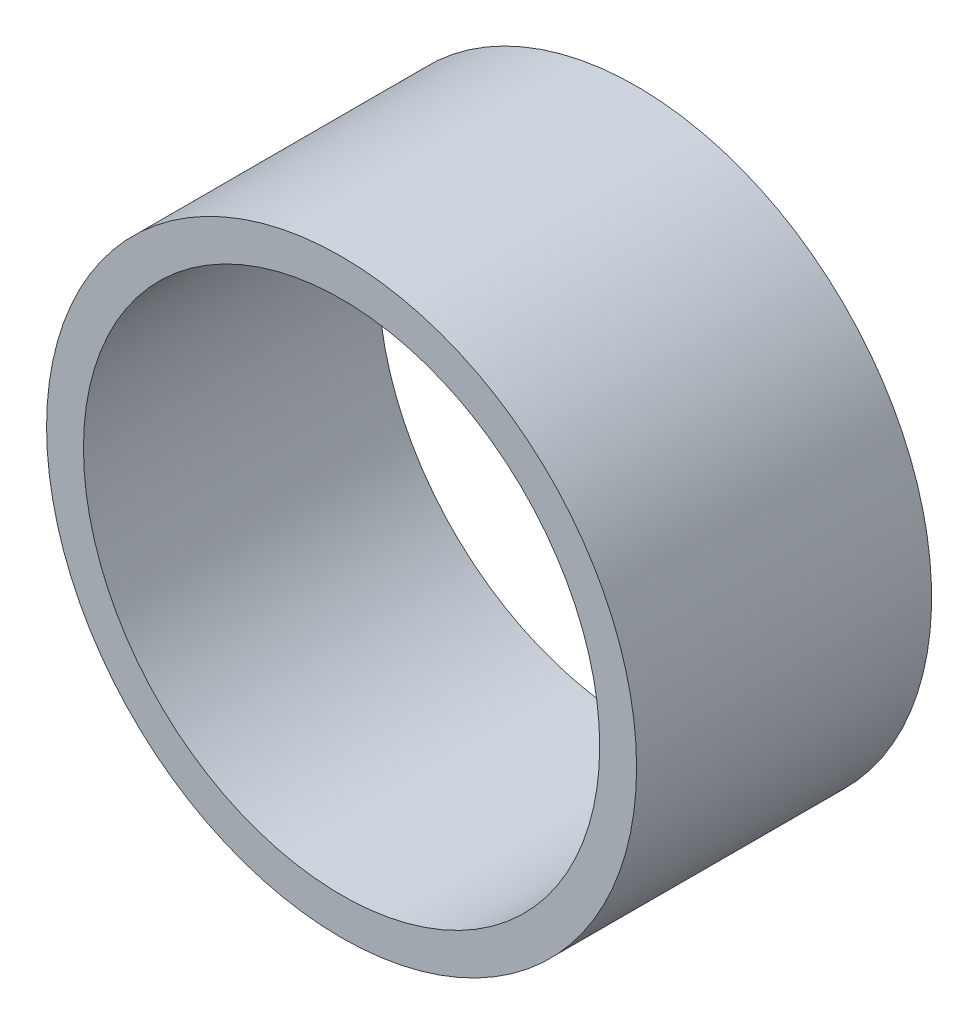
from build123d import *

# Parameters (mm, degrees)
SKETCH1_R               = 12.7
SKETCH1_R_2             = 11.1125
BOSS_EXTRUDE1_DEPTH     = 457.2
CUT_EXTRUDE1_DEPTH      = 25.4
CUT_EXTRUDE1_DEPTH_BACK = 25.4
SKETCH2_W               = 302.505044899
SKETCH2_H               = 503.385333786


with BuildPart() as part:
    # Sketch1 → Boss-Extrude1 (new body)
    with BuildSketch(Plane.XY):
        Circle(SKETCH1_R)
        Circle(SKETCH1_R_2, mode=Mode.SUBTRACT)
    extrude(amount=BOSS_EXTRUDE1_DEPTH)

    # Sketch2 → Cut-Extrude1 (cut, two sides: drawn at the far end of the back side and taken through both)
    with BuildSketch(Plane(origin=(0, 0, 0), x_dir=(1, 0, 0), z_dir=(0, 1, 0)).offset(-CUT_EXTRUDE1_DEPTH_BACK)):
        with Locations((27.564435475, -192.807333107)):
            Rectangle(SKETCH2_W, SKETCH2_H)
    extrude(amount=CUT_EXTRUDE1_DEPTH + CUT_EXTRUDE1_DEPTH_BACK, mode=Mode.SUBTRACT)


solid = part.part
